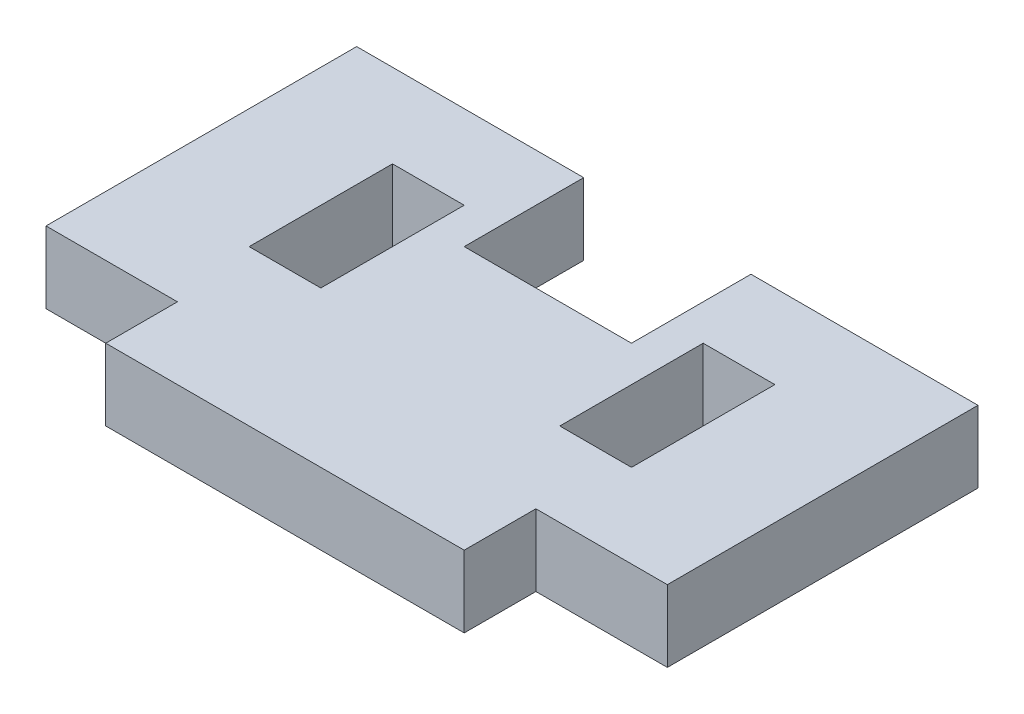
from build123d import *

# Parameters (mm, degrees)
SALIENTE_EXTRUIR1_DEPTH = 3


with BuildPart() as part:
    # Croquis1 → Saliente-Extruir1 (new body)
    with BuildSketch(Plane(origin=(0, 0, 0), x_dir=(1, 0, 0), z_dir=(0, 1, 0))):
        Polygon((0, 0), (15, 0), (15, 3), (20.5, 3), (20.5, 16), (11, 16), (11, 11), (7.5, 11), (4, 11), (4, 16), (-5.5, 16), (-5.5, 3), (0, 3), align=None)
        Polygon((1, 12.5), (2.5, 12.5), (2.5, 6.5), (-0.5, 6.5), (-0.5, 12.5), align=None, mode=Mode.SUBTRACT)
        Polygon((12.5, 6.5), (15.5, 6.5), (15.5, 12.5), (14, 12.5), (12.5, 12.5), align=None, mode=Mode.SUBTRACT)
    extrude(amount=SALIENTE_EXTRUIR1_DEPTH)


solid = part.part
